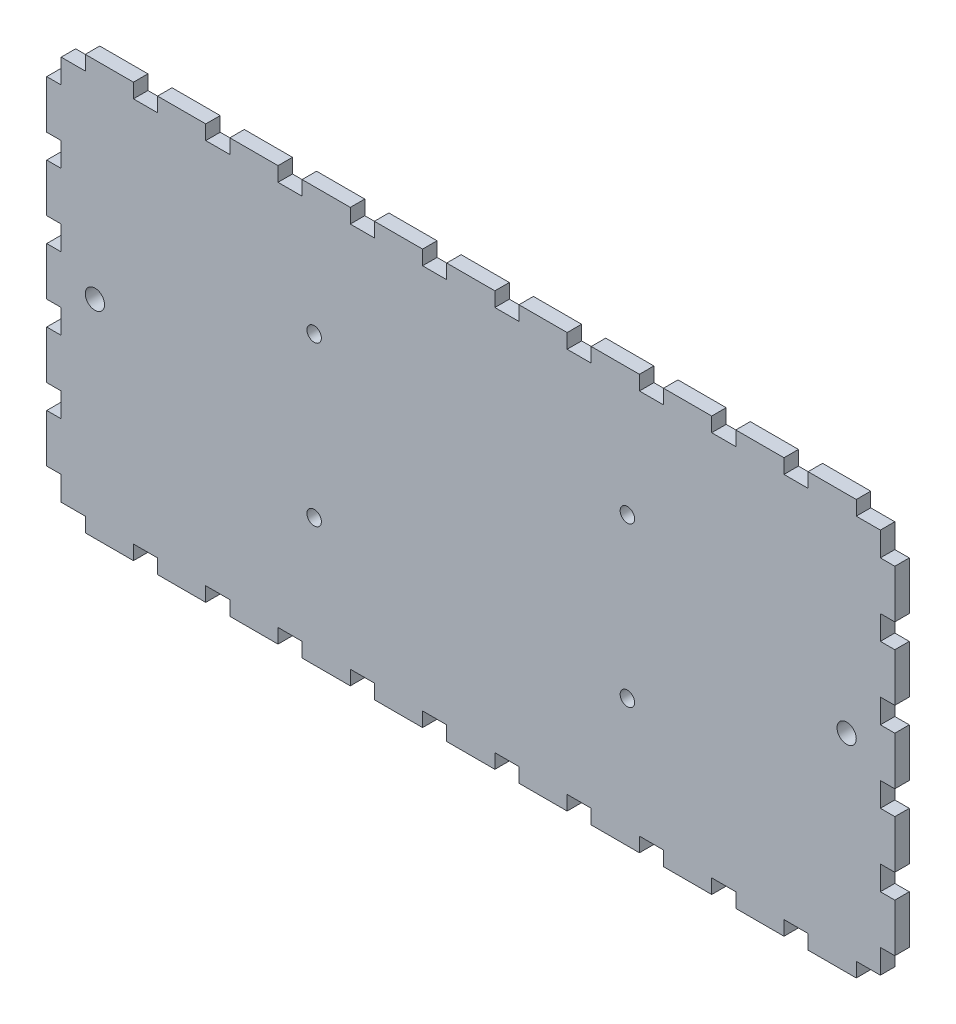
from build123d import *

# Parameters (mm, degrees)
EXTRUDE_1_DEPTH     = 3
SKETCH_3_R          = 1.5
CUT_EXTRUDE_2_DEPTH = 3
SKETCH_4_R          = 2
CUT_EXTRUDE_3_DEPTH = 3


with BuildPart() as part:
    # 草图2 → 凸台-拉伸1 (new body)
    with BuildSketch(Plane.XY):
        Polygon((-85, 40), (-80, 40), (-80, 43), (-70, 43), (-70, 40), (-65, 40), (-65, 43), (-55, 43), (-55, 40), (-50, 40), (-50, 43), (-40, 43), (-40, 40), (-35, 40), (-35, 43), (-25, 43), (-25, 40), (-20, 40), (-20, 43), (-10, 43), (-10, 40), (-5, 40), (-5, 43), (5, 43), (5, 40), (10, 40), (10, 43), (20, 43), (20, 40), (25, 40), (25, 43), (35, 43), (35, 40), (40, 40), (40, 43), (50, 43), (50, 40), (55, 40), (55, 43), (65, 43), (65, 40), (70, 40), (70, 43), (80, 43), (80, 40), (85, 40), (85, 35), (88, 35), (88, 25), (85, 25), (85, 20), (88, 20), (88, 10), (85, 10), (85, 5), (88, 5), (88, -5), (85, -5), (85, -10), (88, -10), (88, -20), (85, -20), (85, -25), (88, -25), (88, -35), (85, -35), (85, -40), (80, -40), (80, -43), (70, -43), (70, -40), (65, -40), (65, -43), (55, -43), (55, -40), (50, -40), (50, -43), (40, -43), (40, -40), (35, -40), (35, -43), (25, -43), (25, -40), (20, -40), (20, -43), (10, -43), (10, -40), (5, -40), (5, -43), (-5, -43), (-5, -40), (-10, -40), (-10, -43), (-20, -43), (-20, -40), (-25, -40), (-25, -43), (-35, -43), (-35, -40), (-40, -40), (-40, -43), (-50, -43), (-50, -40), (-55, -40), (-55, -43), (-65, -43), (-65, -40), (-70, -40), (-70, -43), (-80, -43), (-80, -40), (-85, -40), (-85, -35), (-88, -35), (-88, -25), (-85, -25), (-85, -20), (-88, -20), (-88, -10), (-85, -10), (-85, -5), (-88, -5), (-88, 5), (-85, 5), (-85, 10), (-88, 10), (-88, 20), (-85, 20), (-85, 25), (-88, 25), (-88, 35), (-85, 35), align=None)
    extrude(amount=EXTRUDE_1_DEPTH)

    # 草图3 → 切除-拉伸2 (cut)
    with BuildSketch(Plane.XY.offset(3)):
        with Locations((-32.5, 16.5)):
            Circle(SKETCH_3_R)
        with Locations((32.5, 16.5)):
            Circle(SKETCH_3_R)
        with Locations((32.5, -16.5)):
            Circle(SKETCH_3_R)
        with Locations((-32.5, -16.5)):
            Circle(SKETCH_3_R)
    extrude(amount=-CUT_EXTRUDE_2_DEPTH, mode=Mode.SUBTRACT)

    # 草图4 → 切除-拉伸3 (cut)
    with BuildSketch(Plane.XY.offset(3)):
        with Locations((78, 0)):
            Circle(SKETCH_4_R)
        with Locations((-78, 0)):
            Circle(SKETCH_4_R)
    extrude(amount=-CUT_EXTRUDE_3_DEPTH, mode=Mode.SUBTRACT)


solid = part.part
